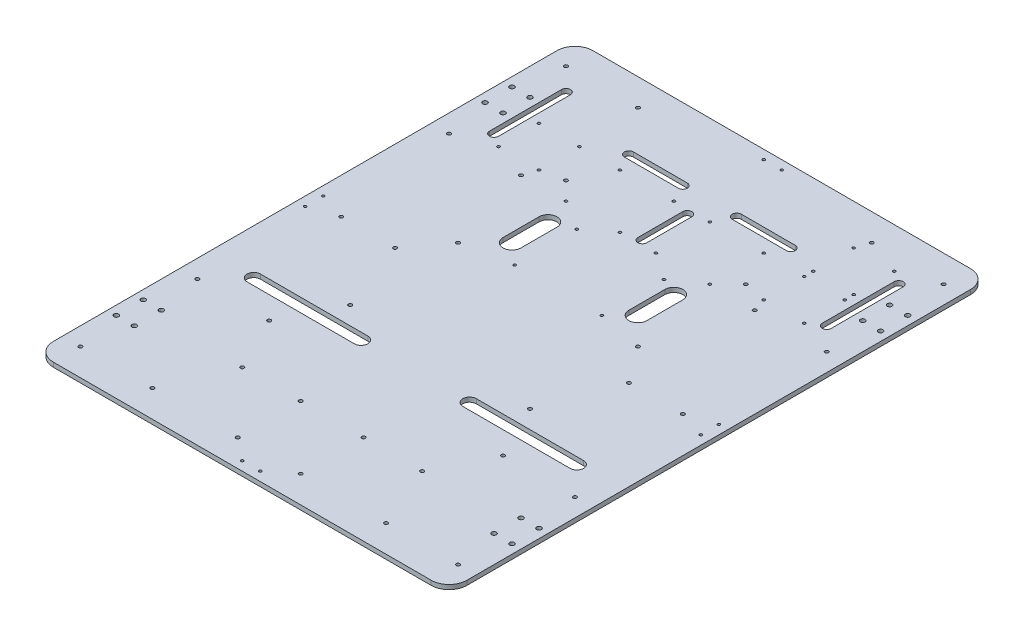
from build123d import *

# Parameters (mm, degrees)
SKETCH_1_R                  = 2
EXTRUDE_378_DEPTH           = 5
SKETCH_2_R                  = 1.5
CUT_EXTRUDE_688_DEPTH       = 379.054228914
SKETCH_3_R                  = 2
CUT_EXTRUDE_1154_DEPTH      = 379.054228914
SKETCH_4_R                  = 2
CUT_EXTRUDE_1585_DEPTH      = 379.054228914
SKETCH_5_R                  = 2.6
CUT_EXTRUDE_2269_DEPTH      = 379.054228914
SKETCH_6_R                  = 2
CUT_EXTRUDE_2401_DEPTH      = 379.054228914
SKETCH_7_R                  = 1.5
CUT_EXTRUDE_2533_DEPTH      = 379.054228914
SKETCH_8_R                  = 1.5
CUT_EXTRUDE_2719_DEPTH      = 379.054228914
SKETCH_9_R                  = 1.5
CUT_EXTRUDE_2956_DEPTH      = 379.054228914
CUT_EXTRUDE_3566_DEPTH      = 379.054228914
CUT_EXTRUDE_3566_DEPTH_BACK = 379.054228914
SKETCH_11_R                 = 2
CUT_EXTRUDE_3701_DEPTH      = 379.054228914


with BuildPart() as part:
    # 草图1 → Extrude 378 (new body)
    with BuildSketch(Plane(origin=(0, 0, 0), x_dir=(1, 0, 0), z_dir=(0, 1, 0))):
        with BuildLine():
            Line((210, -300), (-210, -300))
            ThreePointArc((-210, -300), (-224.142135624, -294.142135624), (-230, -280))
            Line((-230, -280), (-230, 280))
            ThreePointArc((-230, 280), (-224.142135624, 294.142135624), (-210, 300))
            Line((-210, 300), (210, 300))
            ThreePointArc((210, 300), (224.142135624, 294.142135624), (230, 280))
            Line((230, 280), (230, -280))
            ThreePointArc((230, -280), (224.142135624, -294.142135624), (210, -300))
        make_face()
        with Locations(Location((100, -200, 0), (0, 0, 270))):
            Circle(SKETCH_1_R, mode=Mode.SUBTRACT)
        with Locations(Location((100, -80, 0), (0, 0, 270))):
            Circle(SKETCH_1_R, mode=Mode.SUBTRACT)
        with Locations(Location((100, 40, 0), (0, 0, 270))):
            Circle(SKETCH_1_R, mode=Mode.SUBTRACT)
        with Locations(Location((100, 160, 0), (0, 0, 270))):
            Circle(SKETCH_1_R, mode=Mode.SUBTRACT)
    extrude(amount=EXTRUDE_378_DEPTH)

    # 草图2 → Cut-Extrude 688 (cut, through all)
    with BuildSketch(Plane(origin=(0, 5, 0), x_dir=(1, 0, 0), z_dir=(0, 1, 0))):
        with Locations(Location((10, 290, 0), (0, 0, 270))):
            Circle(SKETCH_2_R)
        with Locations(Location((-10, 290, 0), (0, 0, 270))):
            Circle(SKETCH_2_R)
        with Locations(Location((-10, -290, 0), (0, 0, 270))):
            Circle(SKETCH_2_R)
        with Locations(Location((10, -290, 0), (0, 0, 270))):
            Circle(SKETCH_2_R)
        with Locations(Location((-220, 10, 0), (0, 0, 270))):
            Circle(SKETCH_2_R)
        with Locations(Location((-220, -10, 0), (0, 0, 270))):
            Circle(SKETCH_2_R)
        with Locations(Location((220, 10, 0), (0, 0, 270))):
            Circle(SKETCH_2_R)
        with Locations(Location((220, -10, 0), (0, 0, 270))):
            Circle(SKETCH_2_R)
    extrude(amount=-CUT_EXTRUDE_688_DEPTH, mode=Mode.SUBTRACT)

    # 草图3 → Cut-Extrude 1154 (cut, through all)
    with BuildSketch(Plane(origin=(0, 5, 0), x_dir=(1, 0, 0), z_dir=(0, 1, 0))):
        with Locations(Location((-210, 270, 0), (0, 0, 270))):
            Circle(SKETCH_3_R)
        with Locations(Location((-130, 270, 0), (0, 0, 270))):
            Circle(SKETCH_3_R)
        with Locations(Location((-210, 140, 0), (0, 0, 270))):
            Circle(SKETCH_3_R)
        with Locations(Location((-130, 140, 0), (0, 0, 270))):
            Circle(SKETCH_3_R)
        with Locations(Location((130, 270, 0), (0, 0, 270))):
            Circle(SKETCH_3_R)
        with Locations(Location((210, 270, 0), (0, 0, 270))):
            Circle(SKETCH_3_R)
        with Locations(Location((130, 140, 0), (0, 0, 270))):
            Circle(SKETCH_3_R)
        with Locations(Location((210, 140, 0), (0, 0, 270))):
            Circle(SKETCH_3_R)
        with Locations(Location((-210, -140, 0), (0, 0, 270))):
            Circle(SKETCH_3_R)
        with Locations(Location((-130, -140, 0), (0, 0, 270))):
            Circle(SKETCH_3_R)
        with Locations(Location((-210, -270, 0), (0, 0, 270))):
            Circle(SKETCH_3_R)
        with Locations(Location((-130, -270, 0), (0, 0, 270))):
            Circle(SKETCH_3_R)
        with Locations(Location((130, -140, 0), (0, 0, 270))):
            Circle(SKETCH_3_R)
        with Locations(Location((210, -140, 0), (0, 0, 270))):
            Circle(SKETCH_3_R)
        with Locations(Location((130, -270, 0), (0, 0, 270))):
            Circle(SKETCH_3_R)
        with Locations(Location((210, -270, 0), (0, 0, 270))):
            Circle(SKETCH_3_R)
    extrude(amount=-CUT_EXTRUDE_1154_DEPTH, mode=Mode.SUBTRACT)

    # 草图4 → Cut-Extrude 1585 (cut, through all)
    with BuildSketch(Plane(origin=(0, 5, 0), x_dir=(1, 0, 0), z_dir=(0, 1, 0))):
        with Locations(Location((-100, -200, 0), (0, 0, 270))):
            Circle(SKETCH_4_R)
        with Locations(Location((-100, -80, 0), (0, 0, 270))):
            Circle(SKETCH_4_R)
        with Locations(Location((-100, 40, 0), (0, 0, 270))):
            Circle(SKETCH_4_R)
        with Locations(Location((-100, 160, 0), (0, 0, 270))):
            Circle(SKETCH_4_R)
    extrude(amount=-CUT_EXTRUDE_1585_DEPTH, mode=Mode.SUBTRACT)

    # 草图5 → Cut-Extrude 2269 (cut, through all)
    with BuildSketch(Plane(origin=(0, 5, 0), x_dir=(1, 0, 0), z_dir=(0, 1, 0))):
        with Locations(Location((220, -220, 0), (0, 0, 270))):
            Circle(SKETCH_5_R)
        with Locations(Location((200, -220, 0), (0, 0, 270))):
            Circle(SKETCH_5_R)
        with Locations(Location((220, -190, 0), (0, 0, 270))):
            Circle(SKETCH_5_R)
        with Locations(Location((200, -190, 0), (0, 0, 270))):
            Circle(SKETCH_5_R)
        with Locations(Location((-200, -220, 0), (0, 0, 270))):
            Circle(SKETCH_5_R)
        with Locations(Location((-220, -220, 0), (0, 0, 270))):
            Circle(SKETCH_5_R)
        with Locations(Location((-200, -190, 0), (0, 0, 270))):
            Circle(SKETCH_5_R)
        with Locations(Location((-220, -190, 0), (0, 0, 270))):
            Circle(SKETCH_5_R)
        with Locations(Location((200, 190, 0), (0, 0, 270))):
            Circle(SKETCH_5_R)
        with Locations(Location((220, 190, 0), (0, 0, 270))):
            Circle(SKETCH_5_R)
        with Locations(Location((200, 220, 0), (0, 0, 270))):
            Circle(SKETCH_5_R)
        with Locations(Location((220, 220, 0), (0, 0, 270))):
            Circle(SKETCH_5_R)
        with Locations(Location((-200, 190, 0), (0, 0, 270))):
            Circle(SKETCH_5_R)
        with Locations(Location((-220, 190, 0), (0, 0, 270))):
            Circle(SKETCH_5_R)
        with Locations(Location((-200, 220, 0), (0, 0, 270))):
            Circle(SKETCH_5_R)
        with Locations(Location((-220, 220, 0), (0, 0, 270))):
            Circle(SKETCH_5_R)
    extrude(amount=-CUT_EXTRUDE_2269_DEPTH, mode=Mode.SUBTRACT)

    # 草图6 → Cut-Extrude 2401 (cut, through all)
    with BuildSketch(Plane(origin=(0, 5, 0), x_dir=(1, 0, 0), z_dir=(0, 1, 0))):
        with Locations(Location((-35, -270, 0), (0, 0, 270))):
            Circle(SKETCH_6_R)
        with Locations(Location((35, -270, 0), (0, 0, 270))):
            Circle(SKETCH_6_R)
        with Locations(Location((35, -200, 0), (0, 0, 270))):
            Circle(SKETCH_6_R)
        with Locations(Location((-35, -200, 0), (0, 0, 270))):
            Circle(SKETCH_6_R)
    extrude(amount=-CUT_EXTRUDE_2401_DEPTH, mode=Mode.SUBTRACT)

    # 草图7 → Cut-Extrude 2533 (cut, through all)
    with BuildSketch(Plane(origin=(0, 5, 0), x_dir=(1, 0, 0), z_dir=(0, 1, 0))):
        with Locations(Location((50, 50, 0), (0, 0, 270))):
            Circle(SKETCH_7_R)
        with Locations(Location((-47, 50, 0), (0, 0, 270))):
            Circle(SKETCH_7_R)
        with Locations(Location((50, 119, 0), (0, 0, 270))):
            Circle(SKETCH_7_R)
        with Locations(Location((-47, 119, 0), (0, 0, 270))):
            Circle(SKETCH_7_R)
    extrude(amount=-CUT_EXTRUDE_2533_DEPTH, mode=Mode.SUBTRACT)

    # 草图8 → Cut-Extrude 2719 (cut, through all)
    with BuildSketch(Plane(origin=(0, 5, 0), x_dir=(1, 0, 0), z_dir=(0, 1, 0))):
        with Locations(Location((80, 140, 0), (0, 0, 270))):
            Circle(SKETCH_8_R)
        with Locations(Location((20, 140, 0), (0, 0, 270))):
            Circle(SKETCH_8_R)
        with Locations(Location((80, 200, 0), (0, 0, 270))):
            Circle(SKETCH_8_R)
        with Locations(Location((20, 200, 0), (0, 0, 270))):
            Circle(SKETCH_8_R)
        with Locations(Location((-20, 140, 0), (0, 0, 270))):
            Circle(SKETCH_8_R)
        with Locations(Location((-80, 140, 0), (0, 0, 270))):
            Circle(SKETCH_8_R)
        with Locations(Location((-20, 200, 0), (0, 0, 270))):
            Circle(SKETCH_8_R)
        with Locations(Location((-80, 200, 0), (0, 0, 270))):
            Circle(SKETCH_8_R)
    extrude(amount=-CUT_EXTRUDE_2719_DEPTH, mode=Mode.SUBTRACT)

    # 草图9 → Cut-Extrude 2956 (cut, through all)
    with BuildSketch(Plane(origin=(0, 5, 0), x_dir=(1, 0, 0), z_dir=(0, 1, 0))):
        with Locations(Location((170, 155, 0), (0, 0, 270))):
            Circle(SKETCH_9_R)
        with Locations(Location((125, 155, 0), (0, 0, 270))):
            Circle(SKETCH_9_R)
        with Locations(Location((125, 200, 0), (0, 0, 270))):
            Circle(SKETCH_9_R)
        with Locations(Location((170, 200, 0), (0, 0, 270))):
            Circle(SKETCH_9_R)
        with Locations(Location((170, 210, 0), (0, 0, 270))):
            Circle(SKETCH_9_R)
        with Locations(Location((170, 255, 0), (0, 0, 270))):
            Circle(SKETCH_9_R)
        with Locations(Location((125, 210, 0), (0, 0, 270))):
            Circle(SKETCH_9_R)
        with Locations(Location((125, 255, 0), (0, 0, 270))):
            Circle(SKETCH_9_R)
        with Locations(Location((-125, 155, 0), (0, 0, 270))):
            Circle(SKETCH_9_R)
        with Locations(Location((-170, 155, 0), (0, 0, 270))):
            Circle(SKETCH_9_R)
        with Locations(Location((-125, 200, 0), (0, 0, 270))):
            Circle(SKETCH_9_R)
        with Locations(Location((-170, 200, 0), (0, 0, 270))):
            Circle(SKETCH_9_R)
    extrude(amount=-CUT_EXTRUDE_2956_DEPTH, mode=Mode.SUBTRACT)

    # 草图10 → Cut-Extrude 3566 (cut, two sides: drawn at the far end of the back side and taken through both)
    with BuildSketch(Plane(origin=(0, 5, 0), x_dir=(1, 0, 0), z_dir=(0, 1, 0)).offset(-CUT_EXTRUDE_3566_DEPTH_BACK)):
        with BuildLine():
            Line((180, 165), (180, 245))
            ThreePointArc((180, 245), (185, 250), (190, 245))
            Line((190, 245), (190, 165))
            ThreePointArc((190, 165), (185, 160), (180, 165))
        make_face()
        with BuildLine():
            Line((-5, 145), (-5, 195))
            ThreePointArc((-5, 195), (0, 200), (5, 195))
            Line((5, 195), (5, 145))
            ThreePointArc((5, 145), (0, 140), (-5, 145))
        make_face()
        with BuildLine():
            Line((60, 70), (60, 110))
            ThreePointArc((60, 110), (70, 120), (80, 110))
            Line((80, 110), (80, 70))
            ThreePointArc((80, 70), (70, 60), (60, 70))
        make_face()
        with BuildLine():
            Line((-80, 70), (-80, 110))
            ThreePointArc((-80, 110), (-70, 120), (-60, 110))
            Line((-60, 110), (-60, 70))
            ThreePointArc((-60, 70), (-70, 60), (-80, 70))
        make_face()
        with BuildLine():
            Line((90, 215), (30, 215))
            ThreePointArc((30, 215), (25, 220), (30, 225))
            Line((30, 225), (90, 225))
            ThreePointArc((90, 225), (95, 220), (90, 215))
        make_face()
        with BuildLine():
            Line((-30, 215), (-90, 215))
            ThreePointArc((-90, 215), (-95, 220), (-90, 225))
            Line((-90, 225), (-30, 225))
            ThreePointArc((-30, 225), (-25, 220), (-30, 215))
        make_face()
        with BuildLine():
            Line((-190, 165), (-190, 245))
            ThreePointArc((-190, 245), (-185, 250), (-180, 245))
            Line((-180, 245), (-180, 165))
            ThreePointArc((-180, 165), (-185, 160), (-190, 165))
        make_face()
        with BuildLine():
            Line((179.6740558, -115), (60.3259442, -115))
            ThreePointArc((60.3259442, -115), (52.8259442, -107.5), (60.3259442, -100))
            Line((60.3259442, -100), (179.6740558, -100))
            ThreePointArc((179.6740558, -100), (187.1740558, -107.5), (179.6740558, -115))
        make_face()
        with BuildLine():
            Line((-60.3259442, -115), (-179.6740558, -115))
            ThreePointArc((-179.6740558, -115), (-187.1740558, -107.5), (-179.6740558, -100))
            Line((-179.6740558, -100), (-60.3259442, -100))
            ThreePointArc((-60.3259442, -100), (-52.8259442, -107.5), (-60.3259442, -115))
        make_face()
    extrude(amount=CUT_EXTRUDE_3566_DEPTH + CUT_EXTRUDE_3566_DEPTH_BACK, mode=Mode.SUBTRACT)

    # 草图11 → Cut-Extrude 3701 (cut, through all)
    with BuildSketch(Plane(origin=(0, 5, 0), x_dir=(1, 0, 0), z_dir=(0, 1, 0))):
        with Locations(Location((130, 0, 0), (0, 0, 270))):
            Circle(SKETCH_11_R)
        with Locations(Location((190, 0, 0), (0, 0, 270))):
            Circle(SKETCH_11_R)
        with Locations(Location((-130, 0, 0), (0, 0, 270))):
            Circle(SKETCH_11_R)
        with Locations(Location((-190, 0, 0), (0, 0, 270))):
            Circle(SKETCH_11_R)
    extrude(amount=-CUT_EXTRUDE_3701_DEPTH, mode=Mode.SUBTRACT)


solid = part.part
